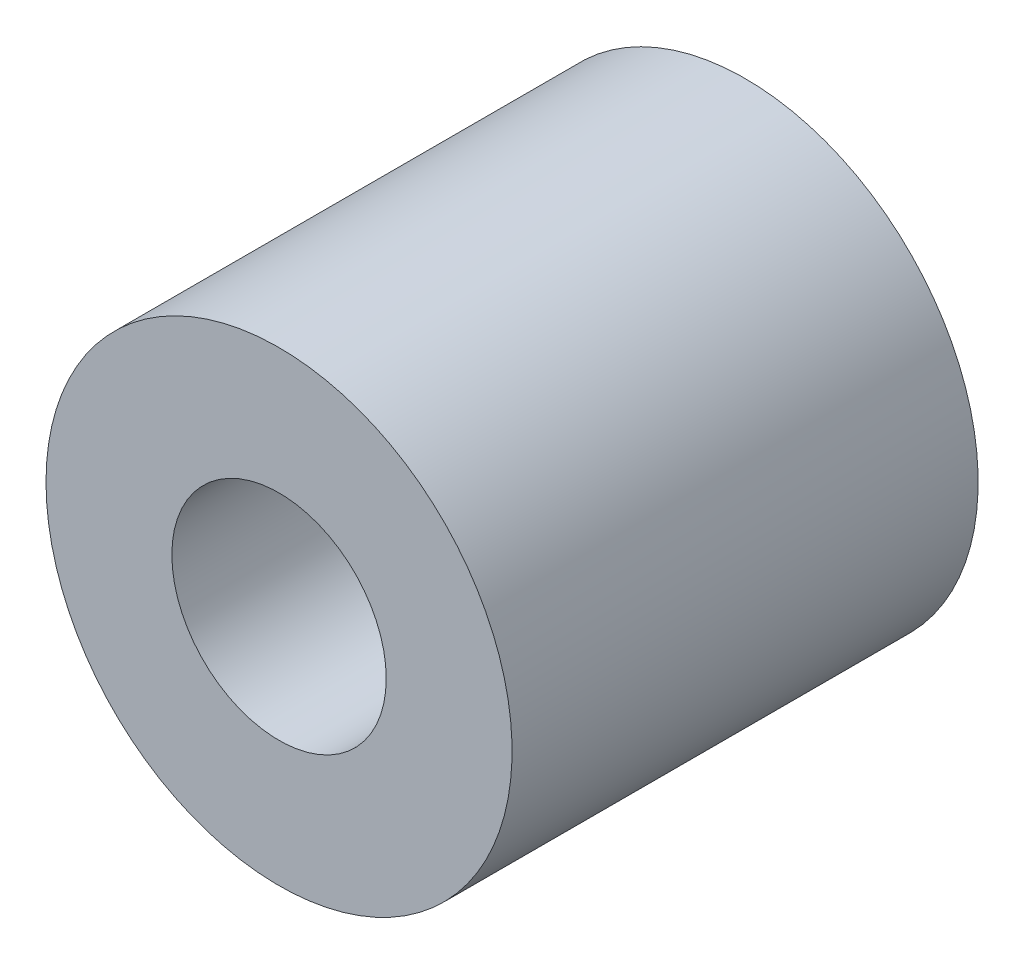
from build123d import *

# Parameters (mm, degrees)
EXTRUDE1_DEPTH      = 3.175
EXTRUDE1_DEPTH_BACK = 3.175
SKETCH1_R           = 3.175
SKETCH1_R_2         = 1.4605


with BuildPart() as part:
    # Sketch1 → Extrude1 (new, two sides: drawn at the far end of the back side and taken through both)
    with BuildSketch(Plane.XY.offset(-EXTRUDE1_DEPTH_BACK)):
        with Locations(Location((0, 0, 0), (0, 0, 180))):
            Circle(SKETCH1_R)
        with Locations(Location((0, 0, 0), (0, 0, 180))):
            Circle(SKETCH1_R_2, mode=Mode.SUBTRACT)
    extrude(amount=EXTRUDE1_DEPTH + EXTRUDE1_DEPTH_BACK)


solid = part.part
